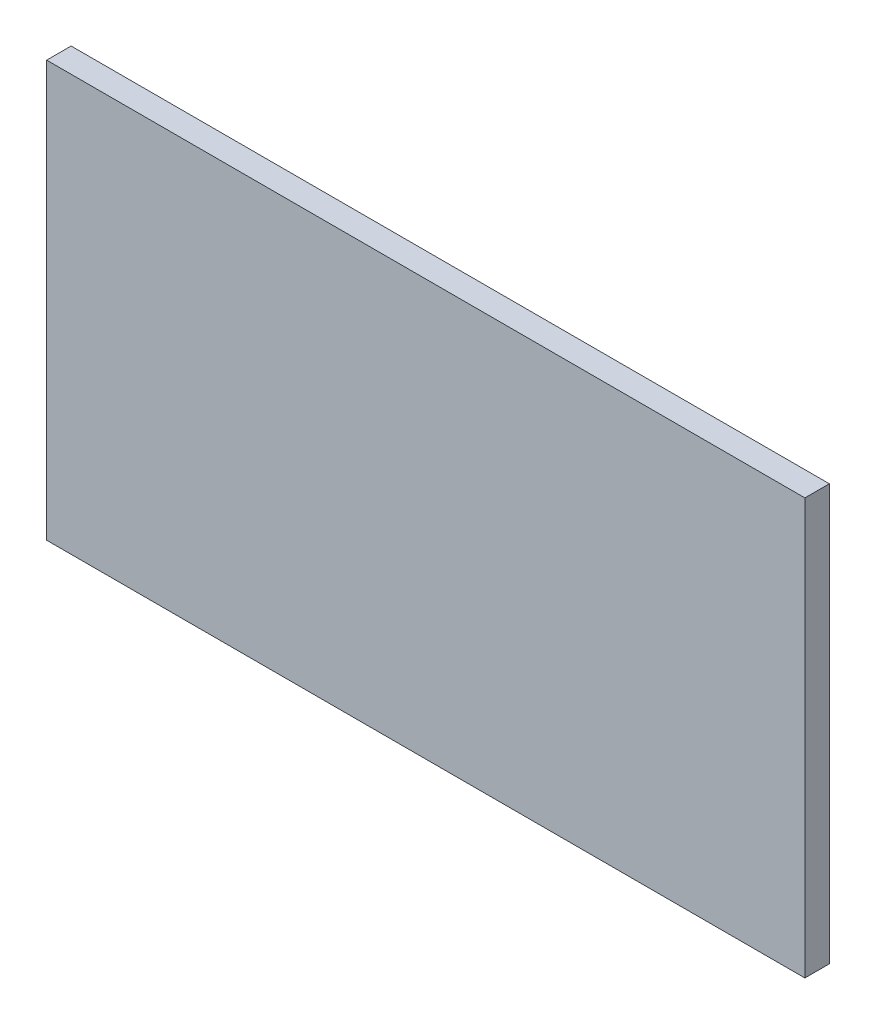
from build123d import *

# Parameters (mm, degrees)
SKETCH1_W           = 196.85
SKETCH1_H           = 107.95
BOSS_EXTRUDE1_DEPTH = 6.35


with BuildPart() as part:
    # Sketch1 → Boss-Extrude1 (new body)
    with BuildSketch(Plane.XY):
        with Locations((15.875, 47.625)):
            Rectangle(SKETCH1_W, SKETCH1_H)
    extrude(amount=BOSS_EXTRUDE1_DEPTH)


solid = part.part
